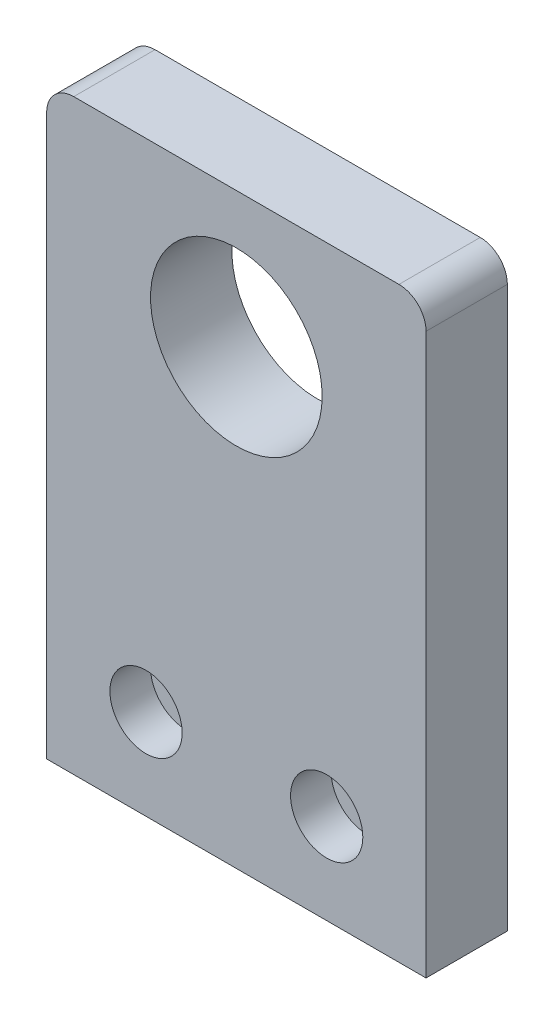
from build123d import *

# Parameters (mm, degrees)
CROQUIS1_R              = 9.5
CROQUIS1_R_2            = 2
SALIENTE_EXTRUIR1_DEPTH = 9
CROQUIS2_R              = 4
CORTAR_EXTRUIR1_DEPTH   = 4.5


with BuildPart() as part:
    # Croquis1 → Saliente-Extruir1 (new body)
    with BuildSketch(Plane.XY):
        with BuildLine():
            Line((-18, 32.5), (18, 32.5))
            ThreePointArc((18, 32.5), (20.121320344, 31.621320344), (21, 29.5))
            Line((21, 29.5), (21, -32.5))
            Line((21, -32.5), (-21, -32.5))
            Line((-21, -32.5), (-21, 29.5))
            ThreePointArc((-21, 29.5), (-20.121320344, 31.621320344), (-18, 32.5))
        make_face()
        with Locations((0, 17.5)):
            Circle(CROQUIS1_R, mode=Mode.SUBTRACT)
        with Locations((10, -22.5)):
            Circle(CROQUIS1_R_2, mode=Mode.SUBTRACT)
        with Locations((-10, -22.5)):
            Circle(CROQUIS1_R_2, mode=Mode.SUBTRACT)
    extrude(amount=SALIENTE_EXTRUIR1_DEPTH)

    # Croquis2 → Cortar-Extruir1 (cut)
    with BuildSketch(Plane.XY.offset(9)):
        with Locations((-10, -22.5)):
            Circle(CROQUIS2_R)
        with Locations((10, -22.5)):
            Circle(CROQUIS2_R)
    extrude(amount=-CORTAR_EXTRUIR1_DEPTH, mode=Mode.SUBTRACT)


solid = part.part
